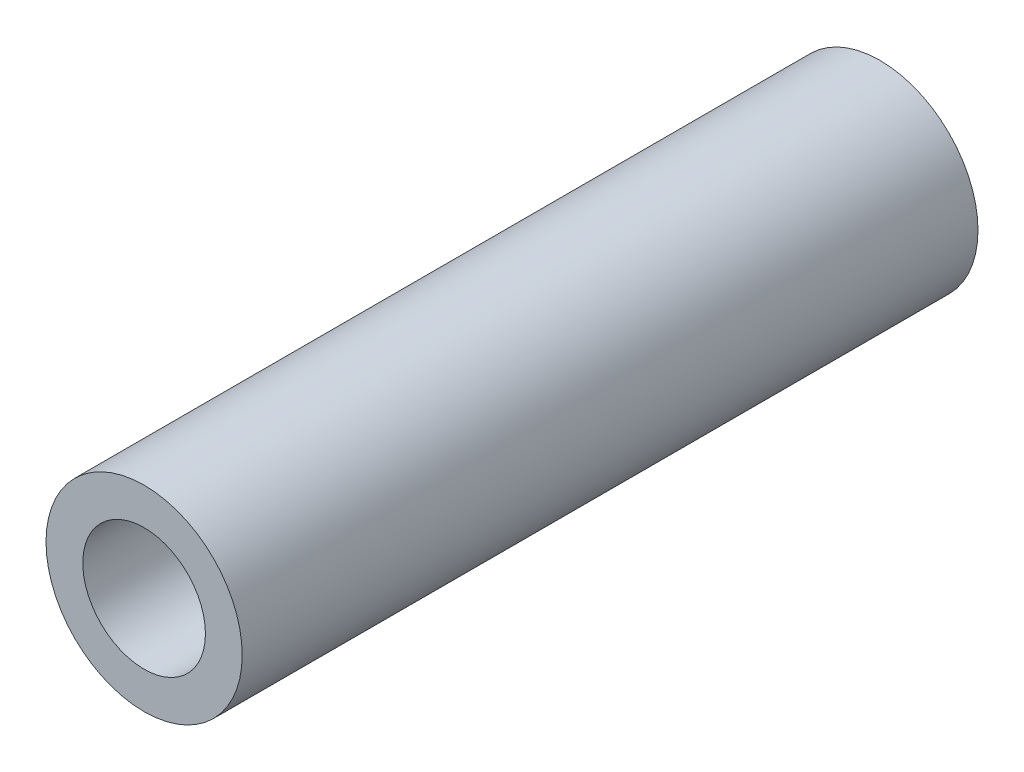
from build123d import *

# Parameters (mm, degrees)
SKETCH1_R           = 12.7
SKETCH1_R_2         = 8.73125
BOSS_EXTRUDE1_DEPTH = 6.35
SKETCH2_R           = 12.7
SKETCH2_R_2         = 7.9375
BOSS_EXTRUDE2_DEPTH = 23.8125
SKETCH5_R           = 12.7
BOSS_EXTRUDE4_DEPTH = 65.0875
SKETCH6_R           = 6.35
SKETCH3_R           = 4.7625


with BuildPart() as part:
    # Sketch1 → Boss-Extrude1 (new body)
    with BuildSketch(Plane.XY):
        Circle(SKETCH1_R)
        Circle(SKETCH1_R_2, mode=Mode.SUBTRACT)
    extrude(amount=BOSS_EXTRUDE1_DEPTH)



with BuildPart() as body_2:
    # Sketch2 → Boss-Extrude2 (new body)
    with BuildSketch(Plane.XY.offset(71.4375)):
        Circle(SKETCH2_R)
        Circle(SKETCH2_R_2, mode=Mode.SUBTRACT)
    extrude(amount=BOSS_EXTRUDE2_DEPTH)


with BuildPart() as part_1:
    add(part.part)

    add(body_2.part)  # Boss-Extrude4 merges body 2
    # Sketch5 → Boss-Extrude4 (add)
    with BuildSketch(Plane.XY.offset(6.35)):
        Circle(SKETCH5_R)
    extrude(amount=BOSS_EXTRUDE4_DEPTH)

    # Sketch6 → Cut-Loft1 section 0
    with BuildSketch(Plane.XY.offset(6.35)):
        Circle(SKETCH6_R)
    # Sketch3 → Cut-Loft1 section 1
    with BuildSketch(Plane(origin=(0, 0, 71.4375), x_dir=(-1, 0, 0), z_dir=(0, 0, -1))):
        Circle(SKETCH3_R)
    loft(mode=Mode.SUBTRACT)


solid = part_1.part
